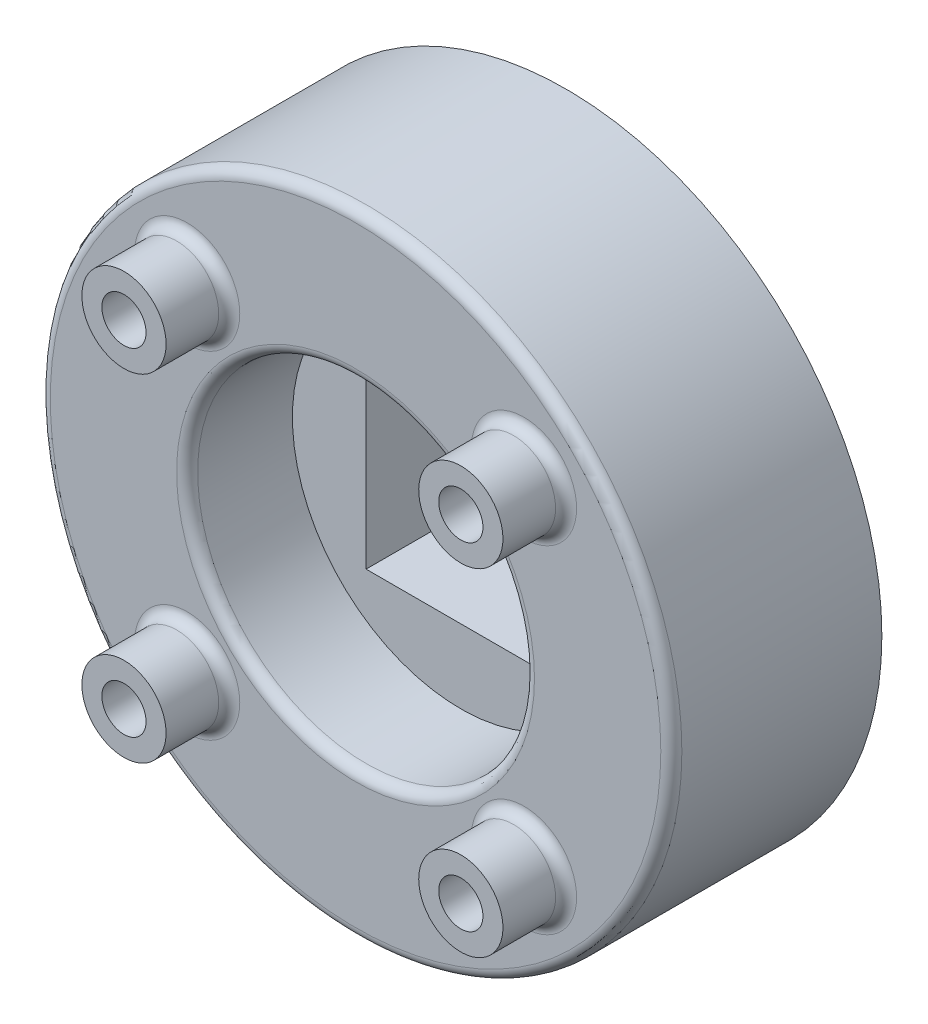
from build123d import *

# Parameters (mm, degrees)
SKETCH2_R                = 75
BASE_EXTRUDE_DEPTH       = 50
SKETCH3_R                = 40
CIRCULAR_CUT_DEPTH       = 25
SKETCH5_W                = 45
SKETCH5_H                = 45
SQUARE_CUT_DEPTH         = 109.972473589
SKETCH6_R                = 10
CIRCULAR_TOWER_DEPTH     = 15
FILLET_1_R               = 2.5
CIRPATTERN_COUNT         = 4
FILLET_1_OF_CIRPATTERN_R = 2.5
FILLET_2_R               = 2.5


with BuildPart() as part:
    # Sketch2 → Base Extrude (new body)
    with BuildSketch(Plane.XY):
        Circle(SKETCH2_R)
    extrude(amount=BASE_EXTRUDE_DEPTH)

    # Sketch3 → Circular Cut (cut)
    with BuildSketch(Plane.XY.offset(50)):
        Circle(SKETCH3_R)
    extrude(amount=-CIRCULAR_CUT_DEPTH, mode=Mode.SUBTRACT)

    # Sketch5 → Square Cut (cut, through all)
    with BuildSketch(Plane.XY.offset(25)):
        Rectangle(SKETCH5_W, SKETCH5_H)
    extrude(amount=-SQUARE_CUT_DEPTH, mode=Mode.SUBTRACT)

    # Sketch6 → Circular Tower (add)
    with BuildSketch(Plane.XY.offset(50)):
        with Locations((-40, 40)):
            Circle(SKETCH6_R)
    circular_tower = extrude(amount=CIRCULAR_TOWER_DEPTH)

    # Fillet 1
    fillet_1_edges = [part.edges().sort_by_distance(p)[0] for p in [
        (-50, 40, 50),
    ]]
    fillet(fillet_1_edges, radius=FILLET_1_R)

    # Sketch8 → M12x1.5 Tapped Hole (revolve, cut)
    with BuildSketch(Plane(origin=(-40, 40, 65), x_dir=(0, -1, 0), z_dir=(1, 0, 0))):
        Polygon((0, 0), (0, 34.65451825), (5.25, 31.5), (5.25, 0), align=None)
    m12x1_5_tapped_hole = revolve(axis=Axis((-40, 40, 71.35), (0, 0, -1)), mode=Mode.SUBTRACT)

    # CirPattern: Circular Tower, M12x1.5 Tapped Hole ×4 about axis
    cirpattern_axis = Axis((0, 0, 0), (0, 0, 1))
    add([circular_tower.rotate(cirpattern_axis, i * 360 / CIRPATTERN_COUNT) for i in range(1, CIRPATTERN_COUNT)])
    add([m12x1_5_tapped_hole.rotate(cirpattern_axis, i * 360 / CIRPATTERN_COUNT) for i in range(1, CIRPATTERN_COUNT)], mode=Mode.SUBTRACT)

    # Fillet 1 of CirPattern
    fillet_1_of_cirpattern_edges = [part.edges().sort_by_distance(p)[0] for p in [
        (-40, -50, 50),
        (50, -40, 50),
        (40, 50, 50),
    ]]
    fillet(fillet_1_of_cirpattern_edges, radius=FILLET_1_OF_CIRPATTERN_R)

    # Fillet 2
    fillet_2_edges = [part.edges().sort_by_distance(p)[0] for p in [
        (-75, 0, 50),
        (-40, 0, 50),
    ]]
    fillet(fillet_2_edges, radius=FILLET_2_R)


solid = part.part
